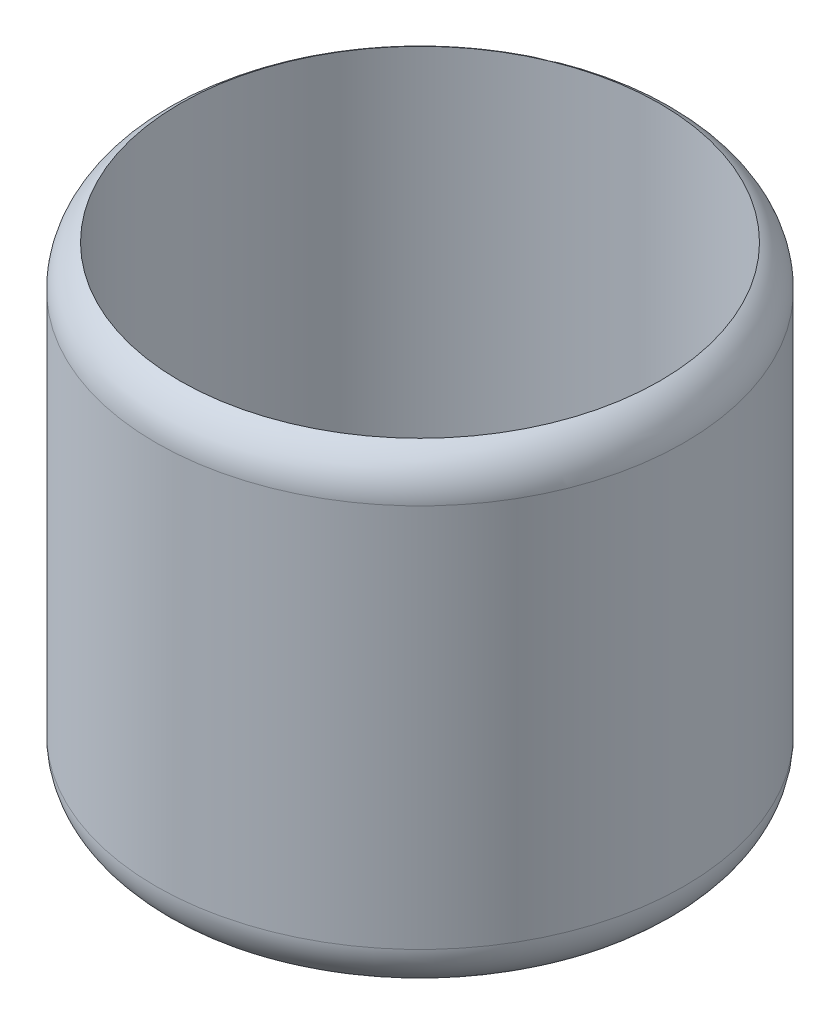
from build123d import *

# Parameters (mm, degrees)
SKETCH1_R           = 55
BOSS_EXTRUDE1_DEPTH = 100
FILLET1_R           = 10
SKETCH3_R           = 50
CUT_EXTRUDE1_DEPTH  = 90


with BuildPart() as part:
    # Sketch1 → Boss-Extrude1 (new body)
    with BuildSketch(Plane(origin=(0, 0, 0), x_dir=(1, 0, 0), z_dir=(0, 1, 0))):
        Circle(SKETCH1_R)
    extrude(amount=BOSS_EXTRUDE1_DEPTH)

    # Fillet1
    fillet1_edges = [part.edges().sort_by_distance(p)[0] for p in [
        (-55, 0, 0),
        (-55, 100, 0),
    ]]
    fillet(fillet1_edges, radius=FILLET1_R)

    # Sketch3 → Cut-Extrude1 (cut)
    with BuildSketch(Plane(origin=(0, 100, 0), x_dir=(1, 0, 0), z_dir=(0, 1, 0))):
        Circle(SKETCH3_R)
    extrude(amount=-CUT_EXTRUDE1_DEPTH, mode=Mode.SUBTRACT)


solid = part.part
